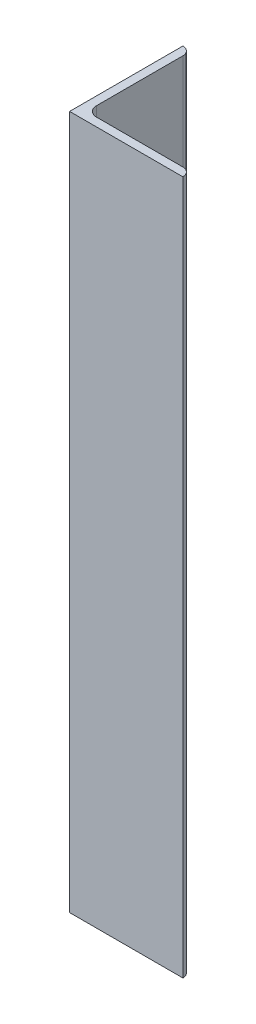
from build123d import *

# Parameters (mm, degrees)
IRON_V40X40X3_1_DEPTH = 245
CUT_EXTRUDE1_DEPTH    = 10


with BuildPart() as part:
    # Sketch1 → Iron V40X40X3(1) (new body)
    with BuildSketch(Plane(origin=(0, 0, 0), x_dir=(1, 0, 0), z_dir=(0, 1, 0))):
        with BuildLine():
            Line((0, 0), (0, 40))
            ThreePointArc((0, 40), (2.121320344, 39.121320344), (3, 37))
            Line((3, 37), (3, 6.5))
            ThreePointArc((3, 6.5), (4.025126266, 4.025126266), (6.5, 3))
            Line((6.5, 3), (37, 3))
            ThreePointArc((37, 3), (39.121320344, 2.121320344), (40, 0))
            Line((40, 0), (0, 0))
        make_face()
    extrude(amount=IRON_V40X40X3_1_DEPTH)

    # Sketch2 → Cut-Extrude1 (cut)
    with BuildSketch(Plane.ZY):
        with BuildLine():
            Line((-25.5, 105), (-10.5, 105))
            ThreePointArc((-10.5, 105), (-5.5, 100), (-10.5, 95))
            Line((-10.5, 95), (-25.5, 95))
            ThreePointArc((-25.5, 95), (-30.5, 100), (-25.5, 105))
        make_face()
        with BuildLine():
            Line((-25.5, 135), (-10.5, 135))
            ThreePointArc((-10.5, 135), (-5.5, 130), (-10.5, 125))
            Line((-10.5, 125), (-25.5, 125))
            ThreePointArc((-25.5, 125), (-30.5, 130), (-25.5, 135))
        make_face()
    extrude(amount=-CUT_EXTRUDE1_DEPTH, mode=Mode.SUBTRACT)


solid = part.part
